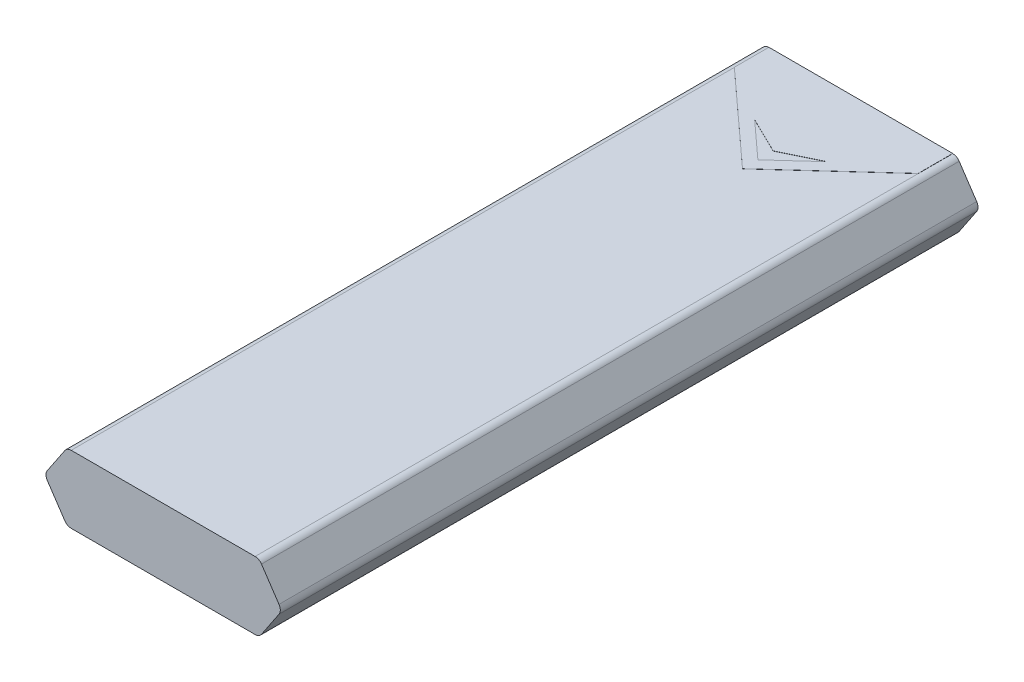
from build123d import *

# Parameters (mm, degrees)
BOSS_EXTRUDE1_DEPTH = 115.316
SKETCH2_R           = 1.1938
CUT_EXTRUDE1_DEPTH  = 6.985
SKETCH2_4_R         = 1.1938
CUT_EXTRUDE2_DEPTH  = 6.985
SKETCH2_5_W         = 5.8674
SKETCH2_5_H         = 2.3876
CUT_EXTRUDE3_DEPTH  = 6.985
FILLET1_R           = 1.27
BOSS_EXTRUDE2_DEPTH = 0.0254
CUT_EXTRUDE5_DEPTH  = 0.0254


with BuildPart() as part:
    # Sketch1 → Boss-Extrude1 (new body)
    with BuildSketch(Plane.XY):
        Polygon((-15.875, -5.588), (15.875, -5.588), (19.6215, 0), (15.875, 5.588), (-15.875, 5.588), (-19.6215, 0), align=None)
    extrude(amount=BOSS_EXTRUDE1_DEPTH)

    # Sketch2 → Cut-Extrude1 (cut)
    with BuildSketch(Plane(origin=(0, 0, 0), x_dir=(-1, 0, 0), z_dir=(0, 0, -1))):
        with Locations((-2.9337, 0)):
            Circle(SKETCH2_R)
    extrude(amount=-CUT_EXTRUDE1_DEPTH, mode=Mode.SUBTRACT)

    # Sketch2<4> → Cut-Extrude2 (cut)
    with BuildSketch(Plane(origin=(0, 0, 0), x_dir=(-1, 0, 0), z_dir=(0, 0, -1))):
        with Locations((2.9337, 0)):
            Circle(SKETCH2_4_R)
    extrude(amount=-CUT_EXTRUDE2_DEPTH, mode=Mode.SUBTRACT)

    # Sketch2<5> → Cut-Extrude3 (cut)
    with BuildSketch(Plane(origin=(0, 0, 0), x_dir=(-1, 0, 0), z_dir=(0, 0, -1))):
        Rectangle(SKETCH2_5_W, SKETCH2_5_H)
    extrude(amount=-CUT_EXTRUDE3_DEPTH, mode=Mode.SUBTRACT)

    # Fillet1
    fillet1_edges = [part.edges().sort_by_distance(p)[0] for p in [
        (15.875, 5.588, 57.658),
        (19.6215, 0, 57.658),
        (15.875, -5.588, 57.658),
        (-15.875, -5.588, 57.658),
        (-19.6215, 0, 57.658),
        (-15.875, 5.588, 57.658),
    ]]
    fillet(fillet1_edges, radius=FILLET1_R)

    # Sketch4 → Boss-Extrude2 (add)
    with BuildSketch(Plane(origin=(0, 5.588, 0), x_dir=(1, 0, 0), z_dir=(0, 1, 0))):
        Polygon((15.19745355, 0), (-15.19745355, 0), (-15.19745355, -5.715), (0, -19.558), (15.19745355, -5.715), align=None)
    boss_extrude2 = extrude(amount=BOSS_EXTRUDE2_DEPTH)

    # Mirror1: Boss-Extrude2 across plane
    add(boss_extrude2.mirror(Plane.ZX))

    # Sketch6 → Cut-Extrude5 (cut)
    with BuildSketch(Plane(origin=(0, 5.6134, 0), x_dir=(1, 0, 0), z_dir=(0, 1, 0))):
        Polygon((0, -17.018), (-6.009529828, -11.544061808), (0, -14.478), (6.009529828, -11.544061808), align=None)
    extrude(amount=-CUT_EXTRUDE5_DEPTH, mode=Mode.SUBTRACT)


solid = part.part
